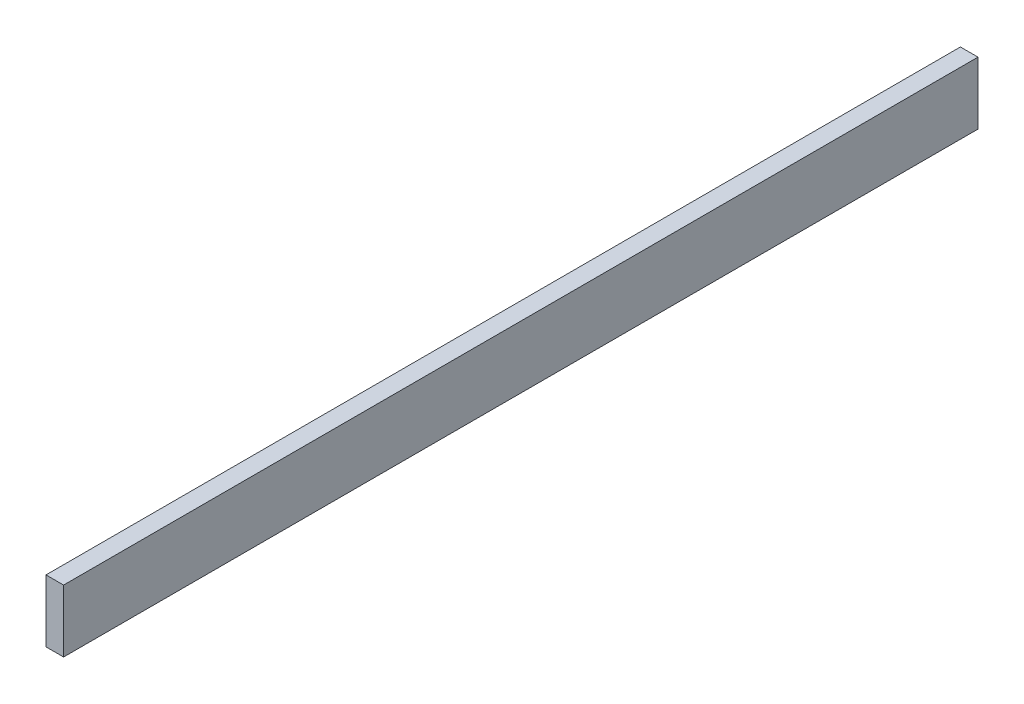
from build123d import *

# Parameters (mm, degrees)
SKETCH1_W                            = 12.7
SKETCH1_H                            = 45
CEK_DONMUS_RAY_IC_PROFIL_SAG_1_DEPTH = 660


with BuildPart() as part:
    # Sketch1 → CEK_donmus_ray_ic_profil_sag_1 (new body)
    with BuildSketch(Plane.XY):
        with Locations((611.65, 40.5)):
            Rectangle(SKETCH1_W, SKETCH1_H)
    extrude(amount=-CEK_DONMUS_RAY_IC_PROFIL_SAG_1_DEPTH)


solid = part.part
